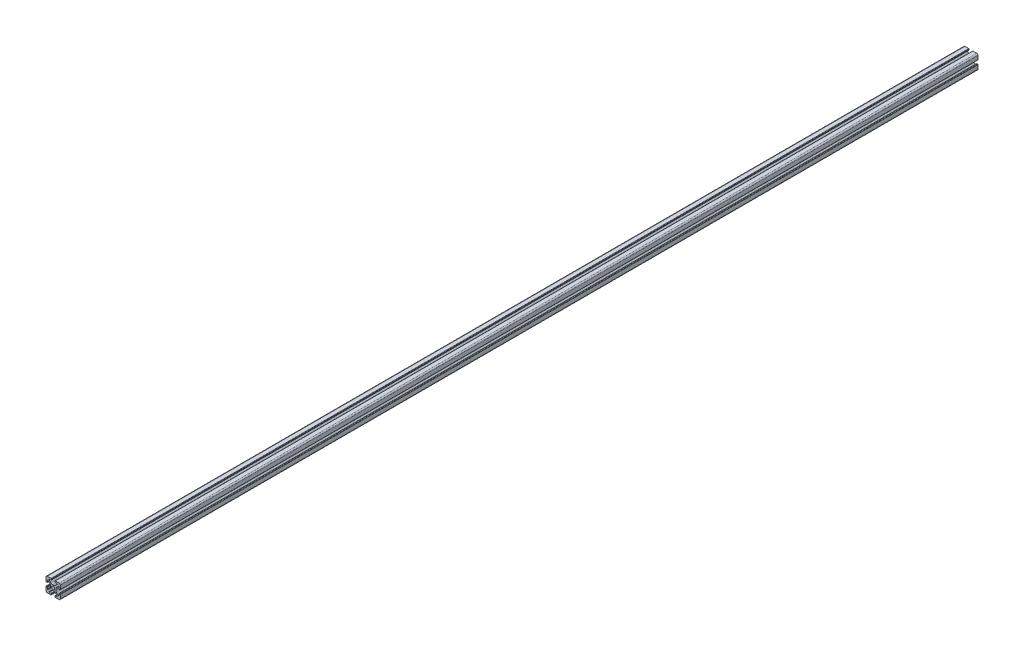
from build123d import *

# Parameters (mm, degrees)
BOSS_EXTRUDE1_DEPTH = 640


with BuildPart() as part:
    # Sketch4 → Boss-Extrude1 (new, symmetric)
    with BuildSketch(Plane.XY):
        with BuildLine():
            Line((3, -10), (8.25, -10))
            ThreePointArc((8.25, -10), (9.487436867, -9.487436867), (10, -8.25))
            Line((10, -8.25), (10, -3))
            ThreePointArc((10, -3), (9.853553391, -2.646446609), (9.5, -2.5))
            Line((9.5, -2.5), (8.424621202, -2.5))
            ThreePointArc((8.424621202, -2.5), (8.071067812, -2.646446609), (7.924621202, -3))
            Line((7.924621202, -3), (7.924621202, -5.25))
            ThreePointArc((7.924621202, -5.25), (7.615962919, -5.711939766), (7.071067812, -5.603553391))
            Line((7.071067812, -5.603553391), (4.478679656, -3.011165235))
            ThreePointArc((4.478679656, -3.011165235), (3.828361402, -2.037895189), (3.6, -0.889844892))
            Line((3.6, -0.889844892), (3.6, 0))
            Line((3.6, 0), (2.15, 0))
            ThreePointArc((2.15, 0), (1.52027958, -1.52027958), (0, -2.15))
            Line((0, -2.15), (0, -3.6))
            Line((0, -3.6), (0.889844892, -3.6))
            ThreePointArc((0.889844892, -3.6), (2.037895189, -3.828361402), (3.011165235, -4.478679656))
            Line((3.011165235, -4.478679656), (5.603553391, -7.071067812))
            ThreePointArc((5.603553391, -7.071067812), (5.711939766, -7.615962919), (5.25, -7.924621202))
            Line((5.25, -7.924621202), (3, -7.924621202))
            ThreePointArc((3, -7.924621202), (2.646446609, -8.071067812), (2.5, -8.424621202))
            Line((2.5, -8.424621202), (2.5, -9.5))
            ThreePointArc((2.5, -9.5), (2.646446609, -9.853553391), (3, -10))
        make_face()
    extrude(amount=BOSS_EXTRUDE1_DEPTH, both=True)

    # Mirror1: part across plane


with BuildPart() as part_1:
    add(part.part)
    add(part.part.mirror(Plane(origin=(0, 0, 0), x_dir=(0, 0, 1), z_dir=(1, 0, 0))))

    # Mirror2: part across plane


with BuildPart() as part_2:
    add(part_1.part)
    add(part_1.part.mirror(Plane.ZX))


solid = part_2.part
